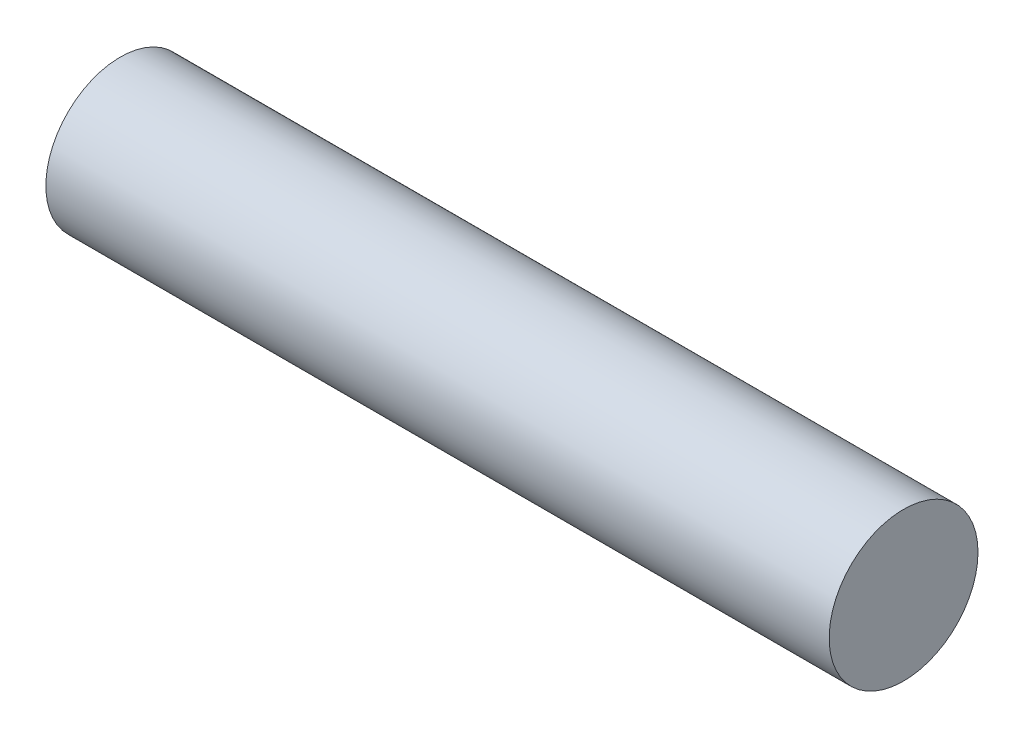
from build123d import *

# Parameters (mm, degrees)
GROUND_GUIDE_ROD_SKETCH_R = 4
GROUND_GUIDE_ROD_DEPTH    = 42.1


with BuildPart() as part:
    # Ground guide rod sketch → Ground guide rod (new body)
    with BuildSketch(Plane(origin=(15.9, 0, 0), x_dir=(0, 0, -1), z_dir=(1, 0, 0))):
        with Locations((28, -9)):
            Circle(GROUND_GUIDE_ROD_SKETCH_R)
    extrude(amount=GROUND_GUIDE_ROD_DEPTH)


solid = part.part
